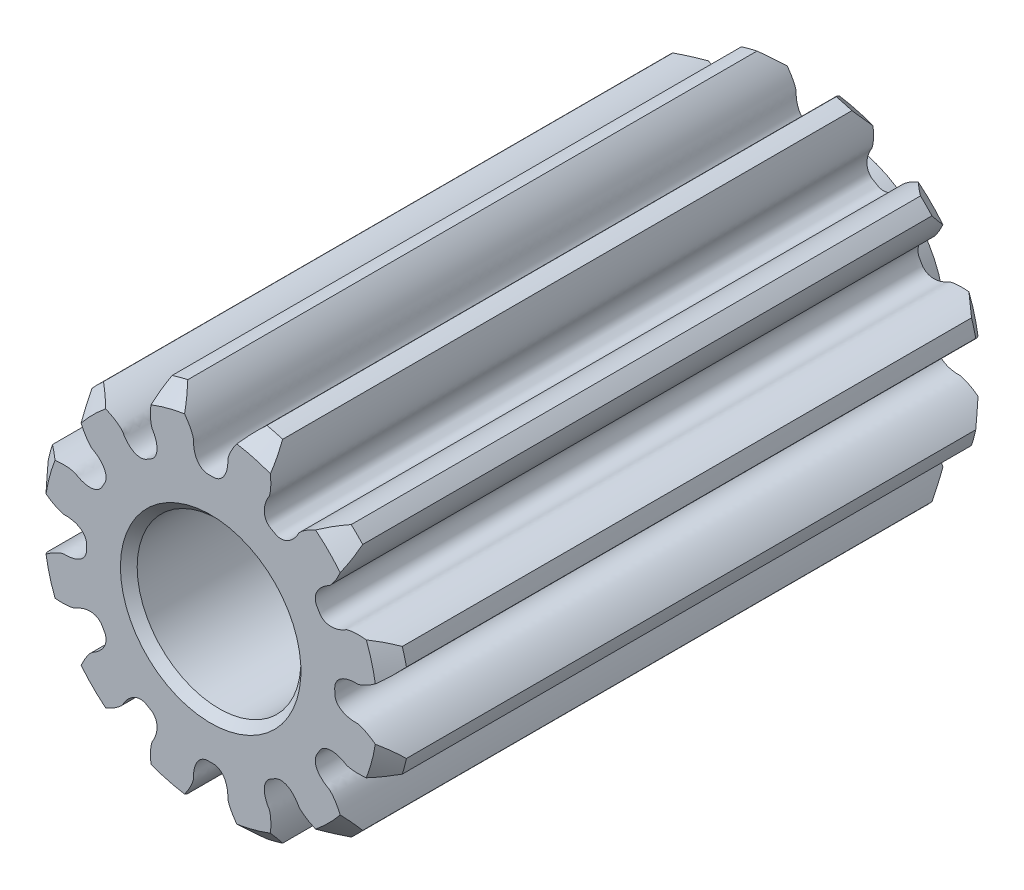
from build123d import *

# Parameters (mm, degrees)
BOSS_EXTRUDE1_DEPTH = 18.25625
SKETCH2_W           = 3.175
SKETCH2_H           = 0.79375
HOLE1_D             = 4.96
CHAMFER1_SIZE       = 0.506249917
CHAMFER2_SIZE       = 0.254


with BuildPart() as part:
    # Sketch1 → Boss-Extrude1 (new body)
    with BuildSketch(Plane(origin=(0, 0, -9.128125), x_dir=(-1, 0, 0), z_dir=(0, 0, -1))):
        with BuildLine():
            ThreePointArc((5.425404811, 1.198705874), (5.366925292, 1.438063298), (5.297891329, 1.674592667))
            add(Edge.make_bspline(
                [(4.099185456, 3.750812144), (4.086881035, 3.688640208), (4.064604326, 3.590945408), (4.02813799, 3.461113263), (3.99626632, 3.362067314), (3.9628593, 3.270211892), (3.928408579, 3.18551446), (3.89340095, 3.107915744), (3.858317055, 3.037330019), (3.823629702, 2.973646168), (3.789804001, 2.916725842), (3.757291548, 2.866411455), (3.726543897, 2.822502764), (3.697965079, 2.784833114), (3.672053296, 2.753036797), (3.641006873, 2.718353198), (3.59159899, 2.664235735), (3.526946165, 2.638473929), (3.483312752, 2.608272859), (3.466630583, 2.596628637), (3.450399741, 2.584768304), (3.434565137, 2.572768612), (3.419140626, 2.560609744), (3.404121993, 2.548296621), (3.389509904, 2.535826904), (3.375303916, 2.523199365), (3.361504116, 2.51041161), (3.348110765, 2.497460614), (3.335124485, 2.484342504), (3.322546306, 2.471052542), (3.310377786, 2.457585059), (3.298621119, 2.443933394), (3.287279279, 2.430089842), (3.276356182, 2.416045606), (3.265856873, 2.401790763), (3.255787748, 2.387314241), (3.246156803, 2.372603823), (3.236973924, 2.357646183), (3.228251208, 2.342426965), (3.220003331, 2.326930917), (3.212247941, 2.311142103), (3.205006094, 2.295044208), (3.198302702, 2.278620954), (3.192166986, 2.261856669), (3.186632917, 2.244737011), (3.181739591, 2.227249898), (3.1775315, 2.20938664), (3.174058639, 2.19114331), (3.171376358, 2.172522315), (3.169544887, 2.153534172), (3.168628422, 2.134199395), (3.168693701, 2.114550391), (3.169807975, 2.094633216), (3.172036424, 2.074508986), (3.175438847, 2.054254629), (3.180066516, 2.033963078), (3.185956648, 2.013741316), (3.193135367, 1.993711363), (3.201589626, 1.973994349), (3.21035214, 1.956736732), (3.228226008, 1.92517919), (3.256197091, 1.879966267), (3.28136709, 1.833136137), (3.299759788, 1.801878143), (3.310324066, 1.785660774), (3.323172372, 1.768480664), (3.33692946, 1.752248735), (3.351496954, 1.737036849), (3.366756118, 1.722883395), (3.382595694, 1.709809632), (3.398909564, 1.697817624), (3.415601207, 1.686894046), (3.432585104, 1.677013012), (3.449787745, 1.668139304), (3.467147694, 1.660231334), (3.484615089, 1.65324376), (3.502150708, 1.64712968), (3.519724787, 1.641842365), (3.537315735, 1.637336553), (3.554908828, 1.633569368), (3.572494983, 1.630500912), (3.590069634, 1.628094593), (3.607631744, 1.626317269), (3.625182952, 1.625139226), (3.642726862, 1.624534073), (3.66026845, 1.624478558), (3.677813586, 1.624952344), (3.695368654, 1.625937778), (3.712940252, 1.627419636), (3.730534962, 1.629384883), (3.748159176, 1.631822445), (3.765818964, 1.63472299), (3.783519987, 1.638078729), (3.801267429, 1.641883235), (3.819065962, 1.646131277), (3.836919719, 1.650818671), (3.854832286, 1.655942154), (3.872806707, 1.661499254), (3.890845471, 1.667488232), (3.908950606, 1.673907813), (3.927123401, 1.680757769), (3.945365544, 1.688036353), (3.963674884, 1.695749677), (3.982061656, 1.703875832), (4.000486931, 1.712500903), (4.048458532, 1.735188012), (4.103095323, 1.778298098), (4.174666362, 1.794027848), (4.220226452, 1.80357304), (4.260718762, 1.810115143), (4.307631045, 1.816030302), (4.361030912, 1.820704202), (4.420860676, 1.823703619), (4.487067974, 1.824537372), (4.559563484, 1.822735576), (4.638234462, 1.817826258), (4.722940736, 1.809344396), (4.813516224, 1.79683088), (4.909768863, 1.779834496), (5.011481006, 1.757913198), (5.14215211, 1.724577899), (5.237896643, 1.695022695), (5.297891329, 1.674592667)],
                knots=[0, 0, 0, 0, 0.042266712, 0.066794083, 0.08991989, 0.111644133, 0.131966811, 0.150887926, 0.168407477, 0.184525464, 0.199241887, 0.212556746, 0.224470042, 0.234981773, 0.24409194, 0.251800543, 0.266086635, 0.292386243, 0.296963202, 0.301485127, 0.305953405, 0.310369519, 0.314735057, 0.319051721, 0.323321334, 0.327545852, 0.331727375, 0.335868154, 0.339970606, 0.344037327, 0.3480711, 0.352074915, 0.356051976, 0.360005716, 0.363939813, 0.367858195, 0.371765054, 0.375664854, 0.37956233, 0.383462485, 0.387370588, 0.391292146, 0.395232877, 0.399198668, 0.403195503, 0.407229386, 0.411306226, 0.415431702, 0.419611098, 0.423849105, 0.428149603, 0.432515421, 0.436948094, 0.441447622, 0.446012269, 0.450638412, 0.455320478, 0.460050978, 0.464820672, 0.469618854, 0.472950852, 0.489007278, 0.505063703, 0.508395701, 0.513193884, 0.517963578, 0.522694077, 0.527376143, 0.532002286, 0.536566933, 0.541066461, 0.545499134, 0.549864952, 0.55416545, 0.558403457, 0.562582853, 0.566708329, 0.570785169, 0.574819052, 0.578815887, 0.582781678, 0.586722409, 0.590643967, 0.59455207, 0.598452225, 0.602349701, 0.606249501, 0.61015636, 0.614074742, 0.618008839, 0.621962579, 0.62593964, 0.629943455, 0.633977228, 0.638043949, 0.642146401, 0.64628718, 0.650468703, 0.654693221, 0.658962834, 0.663279498, 0.667645036, 0.67206115, 0.676529428, 0.681051353, 0.685628312, 0.71192792, 0.726214012, 0.733922615, 0.743032782, 0.753544513, 0.765457809, 0.778772668, 0.793489091, 0.809607078, 0.827126629, 0.846047744, 0.866370423, 0.888094665, 0.911220472, 0.935747843, 0.978014555, 0.978014555, 0.978014555, 0.978014555], degree=3))
            ThreePointArc((4.099185456, 3.750812144), (3.928861994, 3.928861994), (3.750812144, 4.099185455))
            add(Edge.make_bspline(
                [(1.674592667, 5.297891329), (1.695022694, 5.237896643), (1.724577899, 5.14215211), (1.757913198, 5.011481006), (1.779834496, 4.909768863), (1.79683088, 4.813516224), (1.809344396, 4.722940736), (1.817826258, 4.638234462), (1.822735576, 4.559563484), (1.824537372, 4.487067974), (1.823703618, 4.420860676), (1.820704202, 4.361030912), (1.816030301, 4.307631045), (1.810115143, 4.260718762), (1.80357304, 4.220226452), (1.794027848, 4.174666362), (1.778298097, 4.103095323), (1.735188012, 4.048458532), (1.712500903, 4.000486931), (1.703875832, 3.982061656), (1.695749677, 3.963674884), (1.688036353, 3.945365544), (1.680757769, 3.927123401), (1.673907813, 3.908950606), (1.667488232, 3.890845471), (1.661499254, 3.872806707), (1.655942154, 3.854832286), (1.65081867, 3.836919719), (1.646131277, 3.819065962), (1.641883235, 3.801267429), (1.638078729, 3.783519986), (1.63472299, 3.765818964), (1.631822444, 3.748159176), (1.629384882, 3.730534962), (1.627419636, 3.712940252), (1.625937778, 3.695368654), (1.624952344, 3.677813586), (1.624478557, 3.66026845), (1.624534073, 3.642726862), (1.625139226, 3.625182952), (1.626317269, 3.607631744), (1.628094593, 3.590069634), (1.630500911, 3.572494983), (1.633569368, 3.554908828), (1.637336553, 3.537315735), (1.641842365, 3.519724787), (1.64712968, 3.502150707), (1.653243759, 3.484615089), (1.660231334, 3.467147694), (1.668139304, 3.449787745), (1.677013011, 3.432585104), (1.686894046, 3.415601207), (1.697817624, 3.398909564), (1.709809632, 3.382595694), (1.722883395, 3.366756118), (1.737036849, 3.351496954), (1.752248734, 3.33692946), (1.768480664, 3.323172372), (1.785660774, 3.310324066), (1.801878142, 3.299759788), (1.833136137, 3.28136709), (1.879966267, 3.256197091), (1.92517919, 3.228226008), (1.956736732, 3.21035214), (1.973994349, 3.201589626), (1.993711363, 3.193135367), (2.013741315, 3.185956648), (2.033963078, 3.180066516), (2.054254629, 3.175438846), (2.074508986, 3.172036424), (2.094633216, 3.169807975), (2.114550391, 3.168693701), (2.134199395, 3.168628422), (2.153534172, 3.169544887), (2.172522315, 3.171376358), (2.19114331, 3.174058639), (2.20938664, 3.1775315), (2.227249897, 3.181739591), (2.244737011, 3.186632917), (2.261856669, 3.192166986), (2.278620954, 3.198302702), (2.295044207, 3.205006094), (2.311142103, 3.212247941), (2.326930917, 3.220003331), (2.342426965, 3.228251208), (2.357646183, 3.236973924), (2.372603823, 3.246156803), (2.387314241, 3.255787748), (2.401790763, 3.265856873), (2.416045606, 3.276356182), (2.430089841, 3.287279279), (2.443933394, 3.298621119), (2.457585059, 3.310377786), (2.471052542, 3.322546306), (2.484342503, 3.335124485), (2.497460614, 3.348110765), (2.51041161, 3.361504116), (2.523199365, 3.375303916), (2.535826904, 3.389509904), (2.548296621, 3.404121993), (2.560609744, 3.419140626), (2.572768612, 3.434565137), (2.584768304, 3.450399741), (2.596628637, 3.466630583), (2.608272859, 3.483312751), (2.638473929, 3.526946165), (2.664235735, 3.59159899), (2.718353198, 3.641006873), (2.753036797, 3.672053296), (2.784833114, 3.697965079), (2.822502764, 3.726543897), (2.866411455, 3.757291548), (2.916725842, 3.789804), (2.973646168, 3.823629701), (3.037330019, 3.858317055), (3.107915743, 3.89340095), (3.18551446, 3.928408579), (3.270211892, 3.9628593), (3.362067314, 3.99626632), (3.461113263, 4.02813799), (3.590945408, 4.064604326), (3.688640208, 4.086881035), (3.750812144, 4.099185455)],
                knots=[0, 0, 0, 0, 0.042266712, 0.066794083, 0.08991989, 0.111644133, 0.131966811, 0.150887926, 0.168407477, 0.184525464, 0.199241887, 0.212556747, 0.224470042, 0.234981773, 0.24409194, 0.251800544, 0.266086635, 0.292386243, 0.296963202, 0.301485127, 0.305953405, 0.310369519, 0.314735057, 0.319051721, 0.323321334, 0.327545852, 0.331727375, 0.335868154, 0.339970606, 0.344037327, 0.3480711, 0.352074915, 0.356051976, 0.360005716, 0.363939813, 0.367858195, 0.371765054, 0.375664854, 0.37956233, 0.383462485, 0.387370588, 0.391292146, 0.395232877, 0.399198668, 0.403195503, 0.407229386, 0.411306226, 0.415431702, 0.419611098, 0.423849105, 0.428149603, 0.432515421, 0.436948094, 0.441447622, 0.446012269, 0.450638412, 0.455320478, 0.460050978, 0.464820672, 0.469618854, 0.472950852, 0.489007278, 0.505063703, 0.508395701, 0.513193884, 0.517963578, 0.522694077, 0.527376143, 0.532002286, 0.536566933, 0.541066461, 0.545499134, 0.549864952, 0.55416545, 0.558403457, 0.562582853, 0.566708329, 0.570785169, 0.574819052, 0.578815887, 0.582781678, 0.586722409, 0.590643967, 0.59455207, 0.598452225, 0.602349701, 0.606249501, 0.61015636, 0.614074742, 0.618008839, 0.621962579, 0.62593964, 0.629943455, 0.633977228, 0.638043949, 0.642146401, 0.64628718, 0.650468703, 0.654693221, 0.658962834, 0.663279498, 0.667645036, 0.67206115, 0.676529428, 0.681051353, 0.685628312, 0.71192792, 0.726214012, 0.733922615, 0.743032782, 0.753544513, 0.765457809, 0.778772668, 0.793489091, 0.809607078, 0.827126629, 0.846047744, 0.866370423, 0.888094665, 0.911220472, 0.935747843, 0.978014555, 0.978014555, 0.978014555, 0.978014555], degree=3))
            ThreePointArc((1.674592667, 5.297891329), (1.438063298, 5.366925292), (1.198705874, 5.425404811))
            add(Edge.make_bspline(
                [(-1.198705874, 5.425404811), (-1.151015608, 5.383662902), (-1.077547784, 5.315523307), (-0.983343016, 5.21902646), (-0.913502543, 5.14190181), (-0.850656924, 5.067042771), (-0.794532157, 4.994858856), (-0.744833512, 4.925742002), (-0.701246428, 4.860065595), (-0.663438273, 4.79818354), (-0.631056675, 4.740429461), (-0.603739364, 4.687115658), (-0.581087147, 4.638533065), (-0.562753683, 4.594948258), (-0.548173156, 4.556609837), (-0.533659489, 4.512381046), (-0.511496334, 4.442533833), (-0.521512367, 4.373661941), (-0.51717418, 4.320773761), (-0.515431073, 4.300504469), (-0.513275143, 4.280517981), (-0.510800408, 4.260804965), (-0.507982775, 4.241367513), (-0.504828613, 4.222204434), (-0.501335566, 4.203315136), (-0.497502791, 4.184698619), (-0.493328171, 4.166353764), (-0.488808954, 4.148279284), (-0.483941477, 4.13047378), (-0.478721123, 4.112935778), (-0.4731422, 4.095663789), (-0.467197845, 4.078656384), (-0.460879897, 4.061912286), (-0.45417878, 4.045430488), (-0.447083379, 4.029210399), (-0.439580906, 4.01325202), (-0.431656783, 3.997556168), (-0.423294526, 3.982124741), (-0.414475654, 3.966961038), (-0.405179621, 3.952070143), (-0.395383802, 3.937459372), (-0.385063539, 3.923138801), (-0.374192281, 3.909121865), (-0.362741842, 3.895426037), (-0.350682818, 3.882073564), (-0.337985196, 3.869092263), (-0.324619207, 3.856516321), (-0.31055645, 3.844387069), (-0.295771336, 3.832753648), (-0.280242858, 3.821673477), (-0.263956681, 3.811212406), (-0.246907506, 3.801444437), (-0.229101589, 3.79245084), (-0.21055927, 3.784318618), (-0.191317271, 3.777138024), (-0.171430438, 3.770999927), (-0.150972812, 3.76599005), (-0.130037005, 3.762192027), (-0.10873444, 3.759655123), (-0.089407648, 3.758614874), (-0.053141081, 3.758315327), (0, 3.759932534), (0.053141081, 3.758315327), (0.089407648, 3.758614874), (0.10873444, 3.759655123), (0.130037005, 3.762192027), (0.150972812, 3.76599005), (0.171430438, 3.770999927), (0.191317271, 3.777138024), (0.21055927, 3.784318618), (0.229101589, 3.79245084), (0.246907506, 3.801444437), (0.263956681, 3.811212406), (0.280242858, 3.821673477), (0.295771336, 3.832753648), (0.31055645, 3.844387069), (0.324619207, 3.856516321), (0.337985197, 3.869092263), (0.350682818, 3.882073564), (0.362741842, 3.895426037), (0.374192281, 3.909121866), (0.385063539, 3.923138801), (0.395383802, 3.937459372), (0.405179621, 3.952070143), (0.414475654, 3.966961038), (0.423294526, 3.982124741), (0.431656783, 3.997556168), (0.439580906, 4.01325202), (0.447083379, 4.029210399), (0.45417878, 4.045430488), (0.460879897, 4.061912286), (0.467197845, 4.078656384), (0.4731422, 4.095663789), (0.478721123, 4.112935778), (0.483941478, 4.13047378), (0.488808954, 4.148279285), (0.493328171, 4.166353764), (0.497502791, 4.184698619), (0.501335566, 4.203315136), (0.504828613, 4.222204434), (0.507982775, 4.241367513), (0.510800408, 4.260804965), (0.513275143, 4.280517981), (0.515431073, 4.300504469), (0.51717418, 4.320773761), (0.521512367, 4.373661941), (0.511496334, 4.442533833), (0.533659489, 4.512381046), (0.548173156, 4.556609837), (0.562753683, 4.594948258), (0.581087147, 4.638533066), (0.603739364, 4.687115658), (0.631056675, 4.740429461), (0.663438273, 4.79818354), (0.701246428, 4.860065595), (0.744833512, 4.925742002), (0.794532157, 4.994858856), (0.850656924, 5.067042771), (0.913502543, 5.14190181), (0.983343016, 5.219026461), (1.077547784, 5.315523307), (1.151015608, 5.383662902), (1.198705874, 5.425404811)],
                knots=[0, 0, 0, 0, 0.042266712, 0.066794083, 0.08991989, 0.111644133, 0.131966811, 0.150887926, 0.168407477, 0.184525464, 0.199241887, 0.212556747, 0.224470042, 0.234981773, 0.24409194, 0.251800544, 0.266086635, 0.292386243, 0.296963202, 0.301485127, 0.305953405, 0.310369519, 0.314735057, 0.319051721, 0.323321334, 0.327545852, 0.331727375, 0.335868154, 0.339970606, 0.344037327, 0.3480711, 0.352074915, 0.356051976, 0.360005716, 0.363939813, 0.367858195, 0.371765054, 0.375664854, 0.37956233, 0.383462485, 0.387370588, 0.391292146, 0.395232877, 0.399198668, 0.403195503, 0.407229386, 0.411306226, 0.415431702, 0.419611098, 0.423849105, 0.428149603, 0.432515421, 0.436948094, 0.441447622, 0.446012269, 0.450638412, 0.455320478, 0.460050978, 0.464820672, 0.469618854, 0.472950852, 0.489007278, 0.505063703, 0.508395701, 0.513193884, 0.517963578, 0.522694077, 0.527376143, 0.532002286, 0.536566933, 0.541066461, 0.545499134, 0.549864952, 0.55416545, 0.558403457, 0.562582853, 0.566708329, 0.570785169, 0.574819052, 0.578815887, 0.582781678, 0.586722409, 0.590643967, 0.59455207, 0.598452225, 0.602349701, 0.606249501, 0.61015636, 0.614074742, 0.618008839, 0.621962579, 0.62593964, 0.629943455, 0.633977228, 0.638043949, 0.642146401, 0.64628718, 0.650468703, 0.654693221, 0.658962834, 0.663279498, 0.667645036, 0.67206115, 0.676529428, 0.681051353, 0.685628312, 0.71192792, 0.726214012, 0.733922615, 0.743032782, 0.753544513, 0.765457809, 0.778772668, 0.793489091, 0.809607078, 0.827126629, 0.846047744, 0.866370423, 0.888094665, 0.911220472, 0.935747843, 0.978014555, 0.978014555, 0.978014555, 0.978014555], degree=3))
            ThreePointArc((-1.198705874, 5.425404811), (-1.438063298, 5.366925292), (-1.674592667, 5.297891329))
            add(Edge.make_bspline(
                [(-3.750812144, 4.099185456), (-3.688640208, 4.086881035), (-3.590945408, 4.064604326), (-3.461113263, 4.02813799), (-3.362067314, 3.99626632), (-3.270211892, 3.9628593), (-3.18551446, 3.928408579), (-3.107915744, 3.89340095), (-3.037330019, 3.858317055), (-2.973646168, 3.823629702), (-2.916725842, 3.789804001), (-2.866411455, 3.757291548), (-2.822502764, 3.726543897), (-2.784833114, 3.697965079), (-2.753036797, 3.672053296), (-2.718353198, 3.641006873), (-2.664235735, 3.59159899), (-2.638473929, 3.526946165), (-2.608272859, 3.483312752), (-2.596628637, 3.466630583), (-2.584768304, 3.450399741), (-2.572768612, 3.434565137), (-2.560609744, 3.419140626), (-2.548296621, 3.404121993), (-2.535826904, 3.389509904), (-2.523199365, 3.375303916), (-2.51041161, 3.361504116), (-2.497460614, 3.348110765), (-2.484342504, 3.335124485), (-2.471052542, 3.322546306), (-2.457585059, 3.310377786), (-2.443933394, 3.298621119), (-2.430089842, 3.287279279), (-2.416045606, 3.276356182), (-2.401790763, 3.265856873), (-2.387314241, 3.255787748), (-2.372603823, 3.246156803), (-2.357646183, 3.236973924), (-2.342426965, 3.228251208), (-2.326930917, 3.220003331), (-2.311142103, 3.212247941), (-2.295044208, 3.205006094), (-2.278620954, 3.198302702), (-2.261856669, 3.192166986), (-2.244737011, 3.186632917), (-2.227249898, 3.181739591), (-2.20938664, 3.1775315), (-2.19114331, 3.174058639), (-2.172522315, 3.171376358), (-2.153534172, 3.169544887), (-2.134199395, 3.168628422), (-2.114550391, 3.168693701), (-2.094633216, 3.169807975), (-2.074508986, 3.172036424), (-2.054254629, 3.175438847), (-2.033963078, 3.180066516), (-2.013741316, 3.185956648), (-1.993711363, 3.193135367), (-1.973994349, 3.201589626), (-1.956736732, 3.21035214), (-1.92517919, 3.228226008), (-1.879966267, 3.256197091), (-1.833136137, 3.28136709), (-1.801878143, 3.299759788), (-1.785660774, 3.310324066), (-1.768480664, 3.323172372), (-1.752248735, 3.33692946), (-1.737036849, 3.351496954), (-1.722883395, 3.366756118), (-1.709809632, 3.382595694), (-1.697817624, 3.398909564), (-1.686894046, 3.415601207), (-1.677013012, 3.432585104), (-1.668139304, 3.449787745), (-1.660231334, 3.467147694), (-1.65324376, 3.484615089), (-1.64712968, 3.502150707), (-1.641842365, 3.519724787), (-1.637336553, 3.537315735), (-1.633569368, 3.554908828), (-1.630500912, 3.572494983), (-1.628094593, 3.590069634), (-1.626317269, 3.607631744), (-1.625139226, 3.625182952), (-1.624534073, 3.642726862), (-1.624478558, 3.66026845), (-1.624952344, 3.677813586), (-1.625937778, 3.695368654), (-1.627419636, 3.712940252), (-1.629384882, 3.730534962), (-1.631822445, 3.748159176), (-1.63472299, 3.765818964), (-1.638078729, 3.783519986), (-1.641883235, 3.801267429), (-1.646131277, 3.819065962), (-1.650818671, 3.836919719), (-1.655942154, 3.854832286), (-1.661499254, 3.872806707), (-1.667488232, 3.890845471), (-1.673907813, 3.908950606), (-1.680757769, 3.927123401), (-1.688036353, 3.945365544), (-1.695749677, 3.963674884), (-1.703875832, 3.982061656), (-1.712500903, 4.000486931), (-1.735188012, 4.048458532), (-1.778298098, 4.103095323), (-1.794027848, 4.174666362), (-1.80357304, 4.220226452), (-1.810115143, 4.260718762), (-1.816030302, 4.307631045), (-1.820704202, 4.361030912), (-1.823703619, 4.420860676), (-1.824537372, 4.487067974), (-1.822735576, 4.559563484), (-1.817826258, 4.638234462), (-1.809344396, 4.722940736), (-1.79683088, 4.813516224), (-1.779834496, 4.909768863), (-1.757913198, 5.011481006), (-1.724577899, 5.14215211), (-1.695022695, 5.237896643), (-1.674592667, 5.297891329)],
                knots=[0, 0, 0, 0, 0.042266712, 0.066794083, 0.08991989, 0.111644133, 0.131966811, 0.150887926, 0.168407477, 0.184525464, 0.199241887, 0.212556746, 0.224470042, 0.234981773, 0.24409194, 0.251800543, 0.266086635, 0.292386243, 0.296963202, 0.301485127, 0.305953405, 0.310369519, 0.314735057, 0.319051721, 0.323321334, 0.327545852, 0.331727375, 0.335868154, 0.339970606, 0.344037327, 0.3480711, 0.352074915, 0.356051976, 0.360005716, 0.363939813, 0.367858195, 0.371765054, 0.375664854, 0.37956233, 0.383462485, 0.387370588, 0.391292146, 0.395232877, 0.399198668, 0.403195503, 0.407229386, 0.411306226, 0.415431702, 0.419611098, 0.423849105, 0.428149603, 0.432515421, 0.436948094, 0.441447622, 0.446012269, 0.450638412, 0.455320478, 0.460050978, 0.464820672, 0.469618854, 0.472950852, 0.489007278, 0.505063703, 0.508395701, 0.513193884, 0.517963578, 0.522694077, 0.527376143, 0.532002286, 0.536566933, 0.541066461, 0.545499134, 0.549864952, 0.55416545, 0.558403457, 0.562582853, 0.566708329, 0.570785169, 0.574819052, 0.578815887, 0.582781678, 0.586722409, 0.590643967, 0.59455207, 0.598452225, 0.602349701, 0.606249501, 0.61015636, 0.614074742, 0.618008839, 0.621962579, 0.62593964, 0.629943455, 0.633977228, 0.638043949, 0.642146401, 0.64628718, 0.650468703, 0.654693221, 0.658962834, 0.663279498, 0.667645036, 0.67206115, 0.676529428, 0.681051353, 0.685628312, 0.71192792, 0.726214012, 0.733922615, 0.743032782, 0.753544513, 0.765457809, 0.778772668, 0.793489091, 0.809607078, 0.827126629, 0.846047744, 0.866370423, 0.888094665, 0.911220472, 0.935747843, 0.978014555, 0.978014555, 0.978014555, 0.978014555], degree=3))
            ThreePointArc((-3.750812144, 4.099185456), (-3.928861994, 3.928861994), (-4.099185455, 3.750812144))
            add(Edge.make_bspline(
                [(-5.297891329, 1.674592667), (-5.237896643, 1.695022695), (-5.14215211, 1.724577899), (-5.011481006, 1.757913198), (-4.909768863, 1.779834496), (-4.813516224, 1.79683088), (-4.722940736, 1.809344396), (-4.638234462, 1.817826258), (-4.559563484, 1.822735576), (-4.487067974, 1.824537372), (-4.420860676, 1.823703619), (-4.361030912, 1.820704202), (-4.307631045, 1.816030301), (-4.260718762, 1.810115143), (-4.220226452, 1.80357304), (-4.174666362, 1.794027848), (-4.103095323, 1.778298098), (-4.048458532, 1.735188012), (-4.000486931, 1.712500903), (-3.982061656, 1.703875832), (-3.963674884, 1.695749677), (-3.945365544, 1.688036353), (-3.927123401, 1.680757769), (-3.908950606, 1.673907813), (-3.890845471, 1.667488232), (-3.872806707, 1.661499254), (-3.854832286, 1.655942154), (-3.836919719, 1.650818671), (-3.819065962, 1.646131277), (-3.801267429, 1.641883235), (-3.783519986, 1.638078729), (-3.765818964, 1.63472299), (-3.748159176, 1.631822444), (-3.730534962, 1.629384882), (-3.712940252, 1.627419636), (-3.695368654, 1.625937778), (-3.677813586, 1.624952344), (-3.66026845, 1.624478557), (-3.642726862, 1.624534073), (-3.625182952, 1.625139226), (-3.607631744, 1.626317269), (-3.590069634, 1.628094593), (-3.572494982, 1.630500911), (-3.554908828, 1.633569368), (-3.537315735, 1.637336553), (-3.519724787, 1.641842365), (-3.502150707, 1.64712968), (-3.484615089, 1.653243759), (-3.467147694, 1.660231334), (-3.449787745, 1.668139304), (-3.432585104, 1.677013012), (-3.415601207, 1.686894046), (-3.398909564, 1.697817624), (-3.382595694, 1.709809632), (-3.366756118, 1.722883395), (-3.351496954, 1.737036849), (-3.33692946, 1.752248734), (-3.323172372, 1.768480664), (-3.310324066, 1.785660774), (-3.299759788, 1.801878142), (-3.28136709, 1.833136137), (-3.256197091, 1.879966267), (-3.228226008, 1.92517919), (-3.21035214, 1.956736732), (-3.201589626, 1.973994349), (-3.193135367, 1.993711363), (-3.185956648, 2.013741315), (-3.180066516, 2.033963078), (-3.175438846, 2.054254629), (-3.172036424, 2.074508986), (-3.169807975, 2.094633216), (-3.168693701, 2.114550391), (-3.168628422, 2.134199395), (-3.169544887, 2.153534172), (-3.171376358, 2.172522315), (-3.174058639, 2.19114331), (-3.1775315, 2.20938664), (-3.181739591, 2.227249898), (-3.186632917, 2.244737011), (-3.192166986, 2.261856669), (-3.198302701, 2.278620954), (-3.205006094, 2.295044207), (-3.212247941, 2.311142103), (-3.220003331, 2.326930917), (-3.228251208, 2.342426965), (-3.236973924, 2.357646183), (-3.246156803, 2.372603823), (-3.255787748, 2.387314241), (-3.265856873, 2.401790763), (-3.276356182, 2.416045606), (-3.287279279, 2.430089841), (-3.298621119, 2.443933394), (-3.310377786, 2.457585059), (-3.322546306, 2.471052542), (-3.335124485, 2.484342504), (-3.348110765, 2.497460614), (-3.361504116, 2.51041161), (-3.375303916, 2.523199365), (-3.389509904, 2.535826904), (-3.404121993, 2.548296621), (-3.419140626, 2.560609744), (-3.434565137, 2.572768612), (-3.450399741, 2.584768304), (-3.466630583, 2.596628637), (-3.483312751, 2.608272859), (-3.526946165, 2.638473929), (-3.59159899, 2.664235735), (-3.641006873, 2.718353198), (-3.672053296, 2.753036797), (-3.697965079, 2.784833114), (-3.726543897, 2.822502764), (-3.757291548, 2.866411455), (-3.789804, 2.916725842), (-3.823629701, 2.973646168), (-3.858317055, 3.037330019), (-3.89340095, 3.107915743), (-3.928408579, 3.18551446), (-3.9628593, 3.270211892), (-3.99626632, 3.362067314), (-4.02813799, 3.461113263), (-4.064604326, 3.590945408), (-4.086881035, 3.688640208), (-4.099185455, 3.750812144)],
                knots=[0, 0, 0, 0, 0.042266712, 0.066794083, 0.08991989, 0.111644133, 0.131966811, 0.150887926, 0.168407477, 0.184525464, 0.199241887, 0.212556747, 0.224470042, 0.234981773, 0.24409194, 0.251800544, 0.266086635, 0.292386243, 0.296963202, 0.301485127, 0.305953405, 0.310369519, 0.314735057, 0.319051721, 0.323321334, 0.327545852, 0.331727375, 0.335868154, 0.339970606, 0.344037327, 0.3480711, 0.352074915, 0.356051976, 0.360005716, 0.363939813, 0.367858195, 0.371765054, 0.375664854, 0.37956233, 0.383462485, 0.387370588, 0.391292146, 0.395232877, 0.399198668, 0.403195503, 0.407229386, 0.411306226, 0.415431702, 0.419611098, 0.423849105, 0.428149603, 0.432515421, 0.436948094, 0.441447622, 0.446012269, 0.450638412, 0.455320478, 0.460050978, 0.464820672, 0.469618854, 0.472950852, 0.489007278, 0.505063703, 0.508395701, 0.513193884, 0.517963578, 0.522694077, 0.527376143, 0.532002286, 0.536566933, 0.541066461, 0.545499134, 0.549864952, 0.55416545, 0.558403457, 0.562582853, 0.566708329, 0.570785169, 0.574819052, 0.578815887, 0.582781678, 0.586722409, 0.590643967, 0.59455207, 0.598452225, 0.602349701, 0.606249501, 0.61015636, 0.614074742, 0.618008839, 0.621962579, 0.62593964, 0.629943455, 0.633977228, 0.638043949, 0.642146401, 0.64628718, 0.650468703, 0.654693221, 0.658962834, 0.663279498, 0.667645036, 0.67206115, 0.676529428, 0.681051353, 0.685628312, 0.71192792, 0.726214012, 0.733922615, 0.743032782, 0.753544513, 0.765457809, 0.778772668, 0.793489091, 0.809607078, 0.827126629, 0.846047744, 0.866370423, 0.888094665, 0.911220472, 0.935747843, 0.978014555, 0.978014555, 0.978014555, 0.978014555], degree=3))
            ThreePointArc((-5.297891329, 1.674592667), (-5.366925292, 1.438063298), (-5.425404811, 1.198705873))
            add(Edge.make_bspline(
                [(-5.425404811, -1.198705873), (-5.383662902, -1.151015608), (-5.315523307, -1.077547784), (-5.219026461, -0.983343016), (-5.14190181, -0.913502543), (-5.067042771, -0.850656924), (-4.994858856, -0.794532157), (-4.925742002, -0.744833512), (-4.860065595, -0.701246428), (-4.79818354, -0.663438273), (-4.740429461, -0.631056675), (-4.687115658, -0.603739364), (-4.638533066, -0.581087147), (-4.594948258, -0.562753683), (-4.556609837, -0.548173156), (-4.512381046, -0.533659489), (-4.442533833, -0.511496334), (-4.373661941, -0.521512367), (-4.320773762, -0.51717418), (-4.300504469, -0.515431073), (-4.280517981, -0.513275143), (-4.260804965, -0.510800408), (-4.241367513, -0.507982775), (-4.222204434, -0.504828613), (-4.203315136, -0.501335566), (-4.184698619, -0.497502791), (-4.166353764, -0.493328171), (-4.148279285, -0.488808954), (-4.13047378, -0.483941478), (-4.112935778, -0.478721123), (-4.095663789, -0.4731422), (-4.078656384, -0.467197845), (-4.061912286, -0.460879897), (-4.045430488, -0.45417878), (-4.029210399, -0.447083379), (-4.01325202, -0.439580906), (-3.997556168, -0.431656783), (-3.982124741, -0.423294526), (-3.966961038, -0.414475654), (-3.952070143, -0.405179621), (-3.937459372, -0.395383802), (-3.923138801, -0.385063539), (-3.909121866, -0.374192281), (-3.895426037, -0.362741842), (-3.882073564, -0.350682818), (-3.869092263, -0.337985196), (-3.856516321, -0.324619207), (-3.844387069, -0.31055645), (-3.832753649, -0.295771336), (-3.821673477, -0.280242858), (-3.811212406, -0.263956681), (-3.801444437, -0.246907506), (-3.79245084, -0.229101589), (-3.784318618, -0.21055927), (-3.777138024, -0.191317271), (-3.770999927, -0.171430438), (-3.76599005, -0.150972812), (-3.762192027, -0.130037005), (-3.759655123, -0.10873444), (-3.758614874, -0.089407648), (-3.758315327, -0.053141081), (-3.759932534, 0), (-3.758315327, 0.053141081), (-3.758614874, 0.089407648), (-3.759655123, 0.10873444), (-3.762192027, 0.130037005), (-3.76599005, 0.150972812), (-3.770999927, 0.171430438), (-3.777138024, 0.191317271), (-3.784318618, 0.21055927), (-3.79245084, 0.229101589), (-3.801444437, 0.246907506), (-3.811212406, 0.263956681), (-3.821673477, 0.280242858), (-3.832753649, 0.295771336), (-3.844387069, 0.31055645), (-3.856516321, 0.324619207), (-3.869092263, 0.337985196), (-3.882073564, 0.350682818), (-3.895426037, 0.362741842), (-3.909121866, 0.374192281), (-3.923138801, 0.385063539), (-3.937459372, 0.395383802), (-3.952070143, 0.405179621), (-3.966961038, 0.414475654), (-3.982124741, 0.423294526), (-3.997556168, 0.431656783), (-4.01325202, 0.439580906), (-4.029210399, 0.447083379), (-4.045430488, 0.45417878), (-4.061912286, 0.460879897), (-4.078656384, 0.467197845), (-4.095663789, 0.4731422), (-4.112935778, 0.478721123), (-4.13047378, 0.483941478), (-4.148279285, 0.488808954), (-4.166353764, 0.493328171), (-4.184698619, 0.497502791), (-4.203315136, 0.501335566), (-4.222204434, 0.504828613), (-4.241367513, 0.507982775), (-4.260804965, 0.510800408), (-4.280517981, 0.513275143), (-4.300504469, 0.515431073), (-4.320773762, 0.51717418), (-4.373661941, 0.521512367), (-4.442533833, 0.511496334), (-4.512381046, 0.533659489), (-4.556609837, 0.548173156), (-4.594948258, 0.562753683), (-4.638533066, 0.581087147), (-4.687115658, 0.603739364), (-4.740429461, 0.631056675), (-4.79818354, 0.663438273), (-4.860065595, 0.701246428), (-4.925742002, 0.744833512), (-4.994858856, 0.794532157), (-5.067042771, 0.850656924), (-5.14190181, 0.913502543), (-5.219026461, 0.983343016), (-5.315523307, 1.077547784), (-5.383662902, 1.151015608), (-5.425404811, 1.198705873)],
                knots=[0, 0, 0, 0, 0.042266712, 0.066794083, 0.08991989, 0.111644133, 0.131966811, 0.150887926, 0.168407477, 0.184525464, 0.199241887, 0.212556746, 0.224470042, 0.234981773, 0.24409194, 0.251800543, 0.266086635, 0.292386243, 0.296963202, 0.301485127, 0.305953405, 0.310369519, 0.314735057, 0.319051721, 0.323321334, 0.327545852, 0.331727375, 0.335868154, 0.339970606, 0.344037327, 0.3480711, 0.352074915, 0.356051976, 0.360005716, 0.363939813, 0.367858195, 0.371765054, 0.375664854, 0.37956233, 0.383462485, 0.387370588, 0.391292146, 0.395232877, 0.399198668, 0.403195503, 0.407229386, 0.411306226, 0.415431702, 0.419611098, 0.423849105, 0.428149603, 0.432515421, 0.436948094, 0.441447622, 0.446012269, 0.450638412, 0.455320478, 0.460050978, 0.464820672, 0.469618854, 0.472950852, 0.489007278, 0.505063703, 0.508395701, 0.513193884, 0.517963578, 0.522694077, 0.527376143, 0.532002286, 0.536566933, 0.541066461, 0.545499134, 0.549864952, 0.55416545, 0.558403457, 0.562582853, 0.566708329, 0.570785169, 0.574819052, 0.578815887, 0.582781678, 0.586722409, 0.590643967, 0.59455207, 0.598452225, 0.602349701, 0.606249501, 0.61015636, 0.614074742, 0.618008839, 0.621962579, 0.62593964, 0.629943455, 0.633977228, 0.638043949, 0.642146401, 0.64628718, 0.650468703, 0.654693221, 0.658962834, 0.663279498, 0.667645036, 0.67206115, 0.676529428, 0.681051353, 0.685628312, 0.71192792, 0.726214012, 0.733922615, 0.743032782, 0.753544513, 0.765457809, 0.778772668, 0.793489091, 0.809607078, 0.827126629, 0.846047744, 0.866370423, 0.888094665, 0.911220472, 0.935747843, 0.978014555, 0.978014555, 0.978014555, 0.978014555], degree=3))
            ThreePointArc((-5.425404811, -1.198705873), (-5.366925292, -1.438063298), (-5.297891329, -1.674592667))
            add(Edge.make_bspline(
                [(-4.099185455, -3.750812144), (-4.086881035, -3.688640208), (-4.064604326, -3.590945408), (-4.02813799, -3.461113263), (-3.99626632, -3.362067314), (-3.9628593, -3.270211892), (-3.928408579, -3.18551446), (-3.89340095, -3.107915744), (-3.858317055, -3.037330019), (-3.823629701, -2.973646168), (-3.789804, -2.916725843), (-3.757291548, -2.866411455), (-3.726543897, -2.822502764), (-3.697965079, -2.784833115), (-3.672053296, -2.753036797), (-3.641006873, -2.718353198), (-3.59159899, -2.664235735), (-3.526946165, -2.638473929), (-3.483312751, -2.608272859), (-3.466630583, -2.596628637), (-3.450399741, -2.584768304), (-3.434565137, -2.572768612), (-3.419140626, -2.560609744), (-3.404121993, -2.548296621), (-3.389509904, -2.535826904), (-3.375303916, -2.523199365), (-3.361504116, -2.51041161), (-3.348110765, -2.497460614), (-3.335124485, -2.484342504), (-3.322546306, -2.471052543), (-3.310377786, -2.457585059), (-3.298621119, -2.443933394), (-3.287279279, -2.430089842), (-3.276356182, -2.416045606), (-3.265856873, -2.401790763), (-3.255787748, -2.387314241), (-3.246156803, -2.372603823), (-3.236973924, -2.357646184), (-3.228251208, -2.342426965), (-3.220003331, -2.326930917), (-3.212247941, -2.311142103), (-3.205006094, -2.295044208), (-3.198302701, -2.278620954), (-3.192166986, -2.261856669), (-3.186632917, -2.244737011), (-3.181739591, -2.227249898), (-3.1775315, -2.209386641), (-3.174058639, -2.19114331), (-3.171376358, -2.172522315), (-3.169544887, -2.153534172), (-3.168628422, -2.134199395), (-3.168693701, -2.114550391), (-3.169807975, -2.094633216), (-3.172036424, -2.074508986), (-3.175438846, -2.054254629), (-3.180066516, -2.033963078), (-3.185956648, -2.013741316), (-3.193135367, -1.993711363), (-3.201589626, -1.973994349), (-3.21035214, -1.956736732), (-3.228226008, -1.92517919), (-3.256197091, -1.879966267), (-3.281367089, -1.833136137), (-3.299759788, -1.801878143), (-3.310324066, -1.785660774), (-3.323172372, -1.768480664), (-3.33692946, -1.752248735), (-3.351496954, -1.737036849), (-3.366756117, -1.722883395), (-3.382595694, -1.709809632), (-3.398909564, -1.697817624), (-3.415601207, -1.686894046), (-3.432585104, -1.677013012), (-3.449787745, -1.668139305), (-3.467147694, -1.660231334), (-3.484615089, -1.65324376), (-3.502150707, -1.64712968), (-3.519724787, -1.641842365), (-3.537315735, -1.637336553), (-3.554908828, -1.633569368), (-3.572494982, -1.630500912), (-3.590069634, -1.628094593), (-3.607631743, -1.626317269), (-3.625182952, -1.625139226), (-3.642726862, -1.624534074), (-3.66026845, -1.624478558), (-3.677813586, -1.624952345), (-3.695368653, -1.625937778), (-3.712940252, -1.627419636), (-3.730534962, -1.629384883), (-3.748159176, -1.631822445), (-3.765818964, -1.63472299), (-3.783519986, -1.638078729), (-3.801267429, -1.641883235), (-3.819065962, -1.646131277), (-3.836919719, -1.650818671), (-3.854832286, -1.655942154), (-3.872806707, -1.661499254), (-3.890845471, -1.667488232), (-3.908950606, -1.673907813), (-3.927123401, -1.680757769), (-3.945365544, -1.688036353), (-3.963674884, -1.695749677), (-3.982061656, -1.703875832), (-4.000486931, -1.712500903), (-4.048458532, -1.735188012), (-4.103095323, -1.778298098), (-4.174666362, -1.794027848), (-4.220226452, -1.80357304), (-4.260718762, -1.810115143), (-4.307631044, -1.816030302), (-4.361030912, -1.820704202), (-4.420860676, -1.823703619), (-4.487067974, -1.824537372), (-4.559563483, -1.822735576), (-4.638234462, -1.817826258), (-4.722940736, -1.809344396), (-4.813516224, -1.79683088), (-4.909768863, -1.779834496), (-5.011481006, -1.757913198), (-5.14215211, -1.724577899), (-5.237896643, -1.695022695), (-5.297891329, -1.674592667)],
                knots=[0, 0, 0, 0, 0.042266712, 0.066794083, 0.08991989, 0.111644133, 0.131966811, 0.150887926, 0.168407477, 0.184525464, 0.199241887, 0.212556746, 0.224470042, 0.234981773, 0.24409194, 0.251800543, 0.266086635, 0.292386243, 0.296963202, 0.301485127, 0.305953405, 0.310369519, 0.314735057, 0.319051721, 0.323321334, 0.327545852, 0.331727375, 0.335868154, 0.339970606, 0.344037327, 0.3480711, 0.352074915, 0.356051976, 0.360005716, 0.363939813, 0.367858195, 0.371765054, 0.375664854, 0.37956233, 0.383462485, 0.387370588, 0.391292146, 0.395232877, 0.399198668, 0.403195503, 0.407229386, 0.411306226, 0.415431702, 0.419611098, 0.423849105, 0.428149603, 0.432515421, 0.436948094, 0.441447622, 0.446012269, 0.450638412, 0.455320478, 0.460050978, 0.464820672, 0.469618854, 0.472950852, 0.489007278, 0.505063703, 0.508395701, 0.513193884, 0.517963578, 0.522694077, 0.527376143, 0.532002286, 0.536566933, 0.541066461, 0.545499134, 0.549864952, 0.55416545, 0.558403457, 0.562582853, 0.566708329, 0.570785169, 0.574819052, 0.578815887, 0.582781678, 0.586722409, 0.590643967, 0.59455207, 0.598452225, 0.602349701, 0.606249501, 0.61015636, 0.614074742, 0.618008839, 0.621962579, 0.62593964, 0.629943455, 0.633977228, 0.638043949, 0.642146401, 0.64628718, 0.650468703, 0.654693221, 0.658962834, 0.663279498, 0.667645036, 0.67206115, 0.676529428, 0.681051353, 0.685628312, 0.71192792, 0.726214012, 0.733922615, 0.743032782, 0.753544513, 0.765457809, 0.778772668, 0.793489091, 0.809607078, 0.827126629, 0.846047744, 0.866370423, 0.888094665, 0.911220472, 0.935747843, 0.978014555, 0.978014555, 0.978014555, 0.978014555], degree=3))
            ThreePointArc((-4.099185455, -3.750812144), (-3.928861994, -3.928861994), (-3.750812144, -4.099185455))
            add(Edge.make_bspline(
                [(-1.674592667, -5.297891329), (-1.695022694, -5.237896643), (-1.724577899, -5.14215211), (-1.757913198, -5.011481006), (-1.779834496, -4.909768863), (-1.79683088, -4.813516224), (-1.809344396, -4.722940736), (-1.817826258, -4.638234462), (-1.822735576, -4.559563484), (-1.824537372, -4.487067974), (-1.823703618, -4.420860676), (-1.820704202, -4.361030912), (-1.816030301, -4.307631045), (-1.810115143, -4.260718762), (-1.80357304, -4.220226452), (-1.794027848, -4.174666362), (-1.778298097, -4.103095323), (-1.735188012, -4.048458532), (-1.712500903, -4.000486931), (-1.703875832, -3.982061656), (-1.695749677, -3.963674884), (-1.688036353, -3.945365544), (-1.680757769, -3.927123401), (-1.673907813, -3.908950606), (-1.667488231, -3.890845471), (-1.661499254, -3.872806707), (-1.655942154, -3.854832286), (-1.65081867, -3.836919719), (-1.646131277, -3.819065962), (-1.641883235, -3.801267429), (-1.638078729, -3.783519986), (-1.63472299, -3.765818964), (-1.631822444, -3.748159176), (-1.629384882, -3.730534962), (-1.627419635, -3.712940252), (-1.625937778, -3.695368654), (-1.624952344, -3.677813586), (-1.624478557, -3.66026845), (-1.624534073, -3.642726862), (-1.625139226, -3.625182952), (-1.626317269, -3.607631744), (-1.628094593, -3.590069634), (-1.630500911, -3.572494983), (-1.633569368, -3.554908828), (-1.637336553, -3.537315735), (-1.641842365, -3.519724787), (-1.64712968, -3.502150707), (-1.653243759, -3.484615089), (-1.660231334, -3.467147694), (-1.668139304, -3.449787745), (-1.677013011, -3.432585104), (-1.686894046, -3.415601207), (-1.697817624, -3.398909564), (-1.709809632, -3.382595694), (-1.722883395, -3.366756118), (-1.737036849, -3.351496954), (-1.752248734, -3.33692946), (-1.768480664, -3.323172372), (-1.785660774, -3.310324066), (-1.801878142, -3.299759788), (-1.833136137, -3.28136709), (-1.879966267, -3.256197091), (-1.92517919, -3.228226008), (-1.956736732, -3.21035214), (-1.973994349, -3.201589626), (-1.993711363, -3.193135367), (-2.013741315, -3.185956648), (-2.033963078, -3.180066516), (-2.054254629, -3.175438846), (-2.074508986, -3.172036424), (-2.094633216, -3.169807975), (-2.114550391, -3.168693701), (-2.134199395, -3.168628422), (-2.153534172, -3.169544887), (-2.172522315, -3.171376358), (-2.19114331, -3.174058639), (-2.20938664, -3.1775315), (-2.227249897, -3.181739591), (-2.244737011, -3.186632917), (-2.261856669, -3.192166986), (-2.278620954, -3.198302702), (-2.295044207, -3.205006094), (-2.311142103, -3.212247941), (-2.326930917, -3.220003331), (-2.342426965, -3.228251208), (-2.357646183, -3.236973924), (-2.372603823, -3.246156803), (-2.387314241, -3.255787748), (-2.401790763, -3.265856873), (-2.416045606, -3.276356182), (-2.430089841, -3.287279279), (-2.443933394, -3.298621119), (-2.457585059, -3.310377786), (-2.471052542, -3.322546306), (-2.484342503, -3.335124485), (-2.497460614, -3.348110765), (-2.51041161, -3.361504116), (-2.523199365, -3.375303916), (-2.535826904, -3.389509904), (-2.548296621, -3.404121993), (-2.560609744, -3.419140626), (-2.572768612, -3.434565137), (-2.584768304, -3.450399741), (-2.596628637, -3.466630583), (-2.608272859, -3.483312751), (-2.638473929, -3.526946165), (-2.664235735, -3.59159899), (-2.718353198, -3.641006873), (-2.753036797, -3.672053296), (-2.784833114, -3.697965079), (-2.822502764, -3.726543897), (-2.866411455, -3.757291548), (-2.916725842, -3.789804), (-2.973646168, -3.823629701), (-3.037330019, -3.858317055), (-3.107915743, -3.89340095), (-3.18551446, -3.928408579), (-3.270211892, -3.9628593), (-3.362067314, -3.99626632), (-3.461113263, -4.02813799), (-3.590945408, -4.064604326), (-3.688640208, -4.086881035), (-3.750812144, -4.099185455)],
                knots=[0, 0, 0, 0, 0.042266712, 0.066794083, 0.08991989, 0.111644133, 0.131966811, 0.150887926, 0.168407477, 0.184525464, 0.199241887, 0.212556747, 0.224470042, 0.234981773, 0.24409194, 0.251800544, 0.266086635, 0.292386243, 0.296963202, 0.301485127, 0.305953405, 0.310369519, 0.314735057, 0.319051721, 0.323321334, 0.327545852, 0.331727375, 0.335868154, 0.339970606, 0.344037327, 0.3480711, 0.352074915, 0.356051976, 0.360005716, 0.363939813, 0.367858195, 0.371765054, 0.375664854, 0.37956233, 0.383462485, 0.387370588, 0.391292146, 0.395232877, 0.399198668, 0.403195503, 0.407229386, 0.411306226, 0.415431702, 0.419611098, 0.423849105, 0.428149603, 0.432515421, 0.436948094, 0.441447622, 0.446012269, 0.450638412, 0.455320478, 0.460050978, 0.464820672, 0.469618854, 0.472950852, 0.489007278, 0.505063703, 0.508395701, 0.513193884, 0.517963578, 0.522694077, 0.527376143, 0.532002286, 0.536566933, 0.541066461, 0.545499134, 0.549864952, 0.55416545, 0.558403457, 0.562582853, 0.566708329, 0.570785169, 0.574819052, 0.578815887, 0.582781678, 0.586722409, 0.590643967, 0.59455207, 0.598452225, 0.602349701, 0.606249501, 0.61015636, 0.614074742, 0.618008839, 0.621962579, 0.62593964, 0.629943455, 0.633977228, 0.638043949, 0.642146401, 0.64628718, 0.650468703, 0.654693221, 0.658962834, 0.663279498, 0.667645036, 0.67206115, 0.676529428, 0.681051353, 0.685628312, 0.71192792, 0.726214012, 0.733922615, 0.743032782, 0.753544513, 0.765457809, 0.778772668, 0.793489091, 0.809607078, 0.827126629, 0.846047744, 0.866370423, 0.888094665, 0.911220472, 0.935747843, 0.978014555, 0.978014555, 0.978014555, 0.978014555], degree=3))
            ThreePointArc((-1.674592667, -5.297891329), (-1.438063298, -5.366925292), (-1.198705873, -5.425404811))
            add(Edge.make_bspline(
                [(1.198705874, -5.425404811), (1.151015608, -5.383662902), (1.077547784, -5.315523307), (0.983343016, -5.21902646), (0.913502543, -5.14190181), (0.850656924, -5.067042771), (0.794532157, -4.994858856), (0.744833512, -4.925742002), (0.701246428, -4.860065595), (0.663438273, -4.79818354), (0.631056675, -4.740429461), (0.603739364, -4.687115658), (0.581087147, -4.638533065), (0.562753683, -4.594948258), (0.548173156, -4.556609837), (0.533659489, -4.512381046), (0.511496334, -4.442533833), (0.521512367, -4.373661941), (0.51717418, -4.320773761), (0.515431073, -4.300504469), (0.513275143, -4.280517981), (0.510800408, -4.260804965), (0.507982775, -4.241367513), (0.504828613, -4.222204434), (0.501335566, -4.203315136), (0.497502791, -4.184698619), (0.493328171, -4.166353764), (0.488808954, -4.148279284), (0.483941477, -4.13047378), (0.478721123, -4.112935778), (0.4731422, -4.095663789), (0.467197845, -4.078656384), (0.460879897, -4.061912286), (0.45417878, -4.045430488), (0.447083379, -4.029210399), (0.439580906, -4.01325202), (0.431656783, -3.997556168), (0.423294526, -3.982124741), (0.414475654, -3.966961038), (0.405179621, -3.952070143), (0.395383802, -3.937459372), (0.385063539, -3.923138801), (0.374192281, -3.909121865), (0.362741842, -3.895426037), (0.350682818, -3.882073564), (0.337985196, -3.869092263), (0.324619207, -3.856516321), (0.31055645, -3.844387069), (0.295771336, -3.832753648), (0.280242858, -3.821673477), (0.263956681, -3.811212406), (0.246907506, -3.801444437), (0.229101589, -3.79245084), (0.21055927, -3.784318618), (0.191317271, -3.777138024), (0.171430438, -3.770999927), (0.150972812, -3.76599005), (0.130037005, -3.762192027), (0.10873444, -3.759655123), (0.089407648, -3.758614874), (0.053141081, -3.758315327), (0, -3.759932534), (-0.053141081, -3.758315327), (-0.089407648, -3.758614874), (-0.10873444, -3.759655123), (-0.130037005, -3.762192027), (-0.150972812, -3.76599005), (-0.171430438, -3.770999927), (-0.191317271, -3.777138024), (-0.21055927, -3.784318618), (-0.229101589, -3.79245084), (-0.246907506, -3.801444437), (-0.263956681, -3.811212406), (-0.280242858, -3.821673477), (-0.295771336, -3.832753648), (-0.31055645, -3.844387069), (-0.324619207, -3.856516321), (-0.337985197, -3.869092263), (-0.350682818, -3.882073564), (-0.362741842, -3.895426037), (-0.374192281, -3.909121866), (-0.385063539, -3.923138801), (-0.395383802, -3.937459372), (-0.405179621, -3.952070143), (-0.414475654, -3.966961038), (-0.423294526, -3.982124741), (-0.431656783, -3.997556168), (-0.439580906, -4.01325202), (-0.447083379, -4.029210399), (-0.45417878, -4.045430488), (-0.460879897, -4.061912286), (-0.467197845, -4.078656384), (-0.4731422, -4.095663789), (-0.478721123, -4.112935778), (-0.483941478, -4.13047378), (-0.488808954, -4.148279285), (-0.493328171, -4.166353764), (-0.497502791, -4.184698619), (-0.501335566, -4.203315136), (-0.504828613, -4.222204434), (-0.507982775, -4.241367513), (-0.510800408, -4.260804965), (-0.513275143, -4.280517981), (-0.515431073, -4.300504469), (-0.51717418, -4.320773761), (-0.521512367, -4.373661941), (-0.511496334, -4.442533833), (-0.533659489, -4.512381046), (-0.548173156, -4.556609837), (-0.562753683, -4.594948258), (-0.581087147, -4.638533066), (-0.603739364, -4.687115658), (-0.631056675, -4.740429461), (-0.663438273, -4.79818354), (-0.701246428, -4.860065595), (-0.744833512, -4.925742002), (-0.794532157, -4.994858856), (-0.850656924, -5.067042771), (-0.913502543, -5.14190181), (-0.983343016, -5.219026461), (-1.077547784, -5.315523307), (-1.151015608, -5.383662902), (-1.198705873, -5.425404811)],
                knots=[0, 0, 0, 0, 0.042266712, 0.066794083, 0.08991989, 0.111644133, 0.131966811, 0.150887926, 0.168407477, 0.184525464, 0.199241887, 0.212556747, 0.224470042, 0.234981773, 0.24409194, 0.251800544, 0.266086635, 0.292386243, 0.296963202, 0.301485127, 0.305953405, 0.310369519, 0.314735057, 0.319051721, 0.323321334, 0.327545852, 0.331727375, 0.335868154, 0.339970606, 0.344037327, 0.3480711, 0.352074915, 0.356051976, 0.360005716, 0.363939813, 0.367858195, 0.371765054, 0.375664854, 0.37956233, 0.383462485, 0.387370588, 0.391292146, 0.395232877, 0.399198668, 0.403195503, 0.407229386, 0.411306226, 0.415431702, 0.419611098, 0.423849105, 0.428149603, 0.432515421, 0.436948094, 0.441447622, 0.446012269, 0.450638412, 0.455320478, 0.460050978, 0.464820672, 0.469618854, 0.472950852, 0.489007278, 0.505063703, 0.508395701, 0.513193884, 0.517963578, 0.522694077, 0.527376143, 0.532002286, 0.536566933, 0.541066461, 0.545499134, 0.549864952, 0.55416545, 0.558403457, 0.562582853, 0.566708329, 0.570785169, 0.574819052, 0.578815887, 0.582781678, 0.586722409, 0.590643967, 0.59455207, 0.598452225, 0.602349701, 0.606249501, 0.61015636, 0.614074742, 0.618008839, 0.621962579, 0.62593964, 0.629943455, 0.633977228, 0.638043949, 0.642146401, 0.64628718, 0.650468703, 0.654693221, 0.658962834, 0.663279498, 0.667645036, 0.67206115, 0.676529428, 0.681051353, 0.685628312, 0.71192792, 0.726214012, 0.733922615, 0.743032782, 0.753544513, 0.765457809, 0.778772668, 0.793489091, 0.809607078, 0.827126629, 0.846047744, 0.866370423, 0.888094665, 0.911220472, 0.935747843, 0.978014555, 0.978014555, 0.978014555, 0.978014555], degree=3))
            ThreePointArc((1.198705874, -5.425404811), (1.438063298, -5.366925292), (1.674592668, -5.297891329))
            add(Edge.make_bspline(
                [(3.750812144, -4.099185455), (3.688640208, -4.086881035), (3.590945408, -4.064604326), (3.461113263, -4.02813799), (3.362067314, -3.99626632), (3.270211892, -3.9628593), (3.18551446, -3.928408579), (3.107915744, -3.89340095), (3.037330019, -3.858317055), (2.973646168, -3.823629702), (2.916725842, -3.789804), (2.866411455, -3.757291548), (2.822502764, -3.726543897), (2.784833115, -3.697965079), (2.753036797, -3.672053296), (2.718353198, -3.641006873), (2.664235735, -3.59159899), (2.638473929, -3.526946165), (2.608272859, -3.483312751), (2.596628637, -3.466630583), (2.584768304, -3.450399741), (2.572768612, -3.434565137), (2.560609744, -3.419140626), (2.548296621, -3.404121993), (2.535826904, -3.389509904), (2.523199365, -3.375303916), (2.51041161, -3.361504116), (2.497460614, -3.348110765), (2.484342504, -3.335124485), (2.471052542, -3.322546306), (2.457585059, -3.310377786), (2.443933394, -3.298621119), (2.430089842, -3.287279279), (2.416045606, -3.276356182), (2.401790763, -3.265856873), (2.387314241, -3.255787748), (2.372603823, -3.246156803), (2.357646184, -3.236973924), (2.342426965, -3.228251208), (2.326930917, -3.220003331), (2.311142103, -3.212247941), (2.295044208, -3.205006094), (2.278620954, -3.198302702), (2.261856669, -3.192166986), (2.244737011, -3.186632917), (2.227249898, -3.181739591), (2.20938664, -3.1775315), (2.19114331, -3.174058639), (2.172522315, -3.171376358), (2.153534172, -3.169544887), (2.134199395, -3.168628422), (2.114550391, -3.168693701), (2.094633216, -3.169807975), (2.074508986, -3.172036424), (2.054254629, -3.175438846), (2.033963078, -3.180066516), (2.013741316, -3.185956648), (1.993711363, -3.193135367), (1.973994349, -3.201589626), (1.956736732, -3.21035214), (1.92517919, -3.228226008), (1.879966267, -3.256197091), (1.833136137, -3.28136709), (1.801878143, -3.299759788), (1.785660774, -3.310324066), (1.768480664, -3.323172372), (1.752248735, -3.33692946), (1.737036849, -3.351496954), (1.722883395, -3.366756118), (1.709809632, -3.382595694), (1.697817624, -3.398909564), (1.686894046, -3.415601207), (1.677013012, -3.432585104), (1.668139304, -3.449787745), (1.660231334, -3.467147694), (1.65324376, -3.484615089), (1.64712968, -3.502150707), (1.641842365, -3.519724787), (1.637336553, -3.537315735), (1.633569368, -3.554908828), (1.630500912, -3.572494983), (1.628094593, -3.590069634), (1.626317269, -3.607631744), (1.625139226, -3.625182952), (1.624534073, -3.642726862), (1.624478558, -3.66026845), (1.624952344, -3.677813586), (1.625937778, -3.695368654), (1.627419636, -3.712940252), (1.629384883, -3.730534962), (1.631822445, -3.748159176), (1.63472299, -3.765818964), (1.638078729, -3.783519986), (1.641883235, -3.801267429), (1.646131277, -3.819065962), (1.650818671, -3.836919719), (1.655942154, -3.854832286), (1.661499254, -3.872806707), (1.667488232, -3.890845471), (1.673907813, -3.908950606), (1.680757769, -3.927123401), (1.688036353, -3.945365544), (1.695749677, -3.963674884), (1.703875832, -3.982061656), (1.712500903, -4.000486931), (1.735188012, -4.048458532), (1.778298098, -4.103095323), (1.794027848, -4.174666362), (1.80357304, -4.220226452), (1.810115143, -4.260718762), (1.816030302, -4.307631045), (1.820704202, -4.361030912), (1.823703619, -4.420860676), (1.824537372, -4.487067974), (1.822735576, -4.559563484), (1.817826258, -4.638234462), (1.809344396, -4.722940736), (1.79683088, -4.813516224), (1.779834496, -4.909768863), (1.757913198, -5.011481006), (1.724577899, -5.14215211), (1.695022695, -5.237896643), (1.674592668, -5.297891329)],
                knots=[0, 0, 0, 0, 0.042266712, 0.066794083, 0.08991989, 0.111644133, 0.131966811, 0.150887926, 0.168407477, 0.184525464, 0.199241887, 0.212556746, 0.224470042, 0.234981773, 0.24409194, 0.251800543, 0.266086635, 0.292386243, 0.296963202, 0.301485127, 0.305953405, 0.310369519, 0.314735057, 0.319051721, 0.323321334, 0.327545852, 0.331727375, 0.335868154, 0.339970606, 0.344037327, 0.3480711, 0.352074915, 0.356051976, 0.360005716, 0.363939813, 0.367858195, 0.371765054, 0.375664854, 0.37956233, 0.383462485, 0.387370588, 0.391292146, 0.395232877, 0.399198668, 0.403195503, 0.407229386, 0.411306226, 0.415431702, 0.419611098, 0.423849105, 0.428149603, 0.432515421, 0.436948094, 0.441447622, 0.446012269, 0.450638412, 0.455320478, 0.460050978, 0.464820672, 0.469618854, 0.472950852, 0.489007278, 0.505063703, 0.508395701, 0.513193884, 0.517963578, 0.522694077, 0.527376143, 0.532002286, 0.536566933, 0.541066461, 0.545499134, 0.549864952, 0.55416545, 0.558403457, 0.562582853, 0.566708329, 0.570785169, 0.574819052, 0.578815887, 0.582781678, 0.586722409, 0.590643967, 0.59455207, 0.598452225, 0.602349701, 0.606249501, 0.61015636, 0.614074742, 0.618008839, 0.621962579, 0.62593964, 0.629943455, 0.633977228, 0.638043949, 0.642146401, 0.64628718, 0.650468703, 0.654693221, 0.658962834, 0.663279498, 0.667645036, 0.67206115, 0.676529428, 0.681051353, 0.685628312, 0.71192792, 0.726214012, 0.733922615, 0.743032782, 0.753544513, 0.765457809, 0.778772668, 0.793489091, 0.809607078, 0.827126629, 0.846047744, 0.866370423, 0.888094665, 0.911220472, 0.935747843, 0.978014555, 0.978014555, 0.978014555, 0.978014555], degree=3))
            ThreePointArc((3.750812144, -4.099185455), (3.928861994, -3.928861994), (4.099185455, -3.750812144))
            add(Edge.make_bspline(
                [(5.297891329, -1.674592667), (5.237896643, -1.695022695), (5.14215211, -1.724577899), (5.011481006, -1.757913198), (4.909768863, -1.779834496), (4.813516224, -1.79683088), (4.722940736, -1.809344396), (4.638234462, -1.817826258), (4.559563484, -1.822735576), (4.487067974, -1.824537372), (4.420860676, -1.823703618), (4.361030912, -1.820704202), (4.307631045, -1.816030301), (4.260718762, -1.810115143), (4.220226452, -1.80357304), (4.174666362, -1.794027848), (4.103095323, -1.778298097), (4.048458532, -1.735188012), (4.000486931, -1.712500903), (3.982061656, -1.703875832), (3.963674884, -1.695749677), (3.945365544, -1.688036353), (3.927123401, -1.680757769), (3.908950606, -1.673907813), (3.890845471, -1.667488231), (3.872806707, -1.661499254), (3.854832286, -1.655942154), (3.836919719, -1.65081867), (3.819065962, -1.646131277), (3.801267429, -1.641883235), (3.783519987, -1.638078729), (3.765818964, -1.63472299), (3.748159176, -1.631822444), (3.730534962, -1.629384882), (3.712940252, -1.627419635), (3.695368654, -1.625937778), (3.677813586, -1.624952344), (3.66026845, -1.624478557), (3.642726862, -1.624534073), (3.625182952, -1.625139226), (3.607631744, -1.626317269), (3.590069634, -1.628094593), (3.572494983, -1.630500911), (3.554908828, -1.633569368), (3.537315735, -1.637336553), (3.519724787, -1.641842365), (3.502150708, -1.64712968), (3.484615089, -1.653243759), (3.467147694, -1.660231334), (3.449787745, -1.668139304), (3.432585104, -1.677013011), (3.415601207, -1.686894046), (3.398909564, -1.697817624), (3.382595694, -1.709809632), (3.366756118, -1.722883395), (3.351496954, -1.737036849), (3.33692946, -1.752248734), (3.323172372, -1.768480664), (3.310324066, -1.785660774), (3.299759788, -1.801878142), (3.28136709, -1.833136137), (3.256197091, -1.879966267), (3.228226008, -1.92517919), (3.21035214, -1.956736732), (3.201589626, -1.973994349), (3.193135367, -1.993711363), (3.185956648, -2.013741315), (3.180066516, -2.033963078), (3.175438847, -2.054254629), (3.172036424, -2.074508986), (3.169807975, -2.094633216), (3.168693701, -2.114550391), (3.168628422, -2.134199395), (3.169544887, -2.153534172), (3.171376358, -2.172522315), (3.174058639, -2.19114331), (3.1775315, -2.20938664), (3.181739591, -2.227249897), (3.186632917, -2.244737011), (3.192166986, -2.261856669), (3.198302702, -2.278620954), (3.205006094, -2.295044207), (3.212247941, -2.311142103), (3.220003331, -2.326930917), (3.228251208, -2.342426965), (3.236973924, -2.357646183), (3.246156803, -2.372603823), (3.255787748, -2.387314241), (3.265856873, -2.401790763), (3.276356182, -2.416045606), (3.287279279, -2.430089841), (3.298621119, -2.443933394), (3.310377786, -2.457585059), (3.322546306, -2.471052542), (3.335124485, -2.484342503), (3.348110765, -2.497460614), (3.361504116, -2.51041161), (3.375303916, -2.523199365), (3.389509904, -2.535826904), (3.404121993, -2.54829662), (3.419140626, -2.560609744), (3.434565137, -2.572768612), (3.450399741, -2.584768304), (3.466630583, -2.596628637), (3.483312752, -2.608272859), (3.526946165, -2.638473929), (3.59159899, -2.664235735), (3.641006873, -2.718353198), (3.672053296, -2.753036797), (3.697965079, -2.784833114), (3.726543897, -2.822502764), (3.757291548, -2.866411455), (3.789804, -2.916725842), (3.823629702, -2.973646168), (3.858317055, -3.037330019), (3.89340095, -3.107915743), (3.928408579, -3.18551446), (3.9628593, -3.270211892), (3.99626632, -3.362067314), (4.02813799, -3.461113263), (4.064604326, -3.590945408), (4.086881035, -3.688640208), (4.099185455, -3.750812144)],
                knots=[0, 0, 0, 0, 0.042266712, 0.066794083, 0.08991989, 0.111644133, 0.131966811, 0.150887926, 0.168407477, 0.184525464, 0.199241887, 0.212556746, 0.224470042, 0.234981773, 0.24409194, 0.251800543, 0.266086635, 0.292386243, 0.296963202, 0.301485127, 0.305953405, 0.310369519, 0.314735057, 0.319051721, 0.323321334, 0.327545852, 0.331727375, 0.335868154, 0.339970606, 0.344037327, 0.3480711, 0.352074915, 0.356051976, 0.360005716, 0.363939813, 0.367858195, 0.371765054, 0.375664854, 0.37956233, 0.383462485, 0.387370588, 0.391292146, 0.395232877, 0.399198668, 0.403195503, 0.407229386, 0.411306226, 0.415431702, 0.419611098, 0.423849105, 0.428149603, 0.432515421, 0.436948094, 0.441447622, 0.446012269, 0.450638412, 0.455320478, 0.460050978, 0.464820672, 0.469618854, 0.472950852, 0.489007278, 0.505063703, 0.508395701, 0.513193884, 0.517963578, 0.522694077, 0.527376143, 0.532002286, 0.536566933, 0.541066461, 0.545499134, 0.549864952, 0.55416545, 0.558403457, 0.562582853, 0.566708329, 0.570785169, 0.574819052, 0.578815887, 0.582781678, 0.586722409, 0.590643967, 0.59455207, 0.598452225, 0.602349701, 0.606249501, 0.61015636, 0.614074742, 0.618008839, 0.621962579, 0.62593964, 0.629943455, 0.633977228, 0.638043949, 0.642146401, 0.64628718, 0.650468703, 0.654693221, 0.658962834, 0.663279498, 0.667645036, 0.67206115, 0.676529428, 0.681051353, 0.685628312, 0.71192792, 0.726214012, 0.733922615, 0.743032782, 0.753544513, 0.765457809, 0.778772668, 0.793489091, 0.809607078, 0.827126629, 0.846047744, 0.866370423, 0.888094665, 0.911220472, 0.935747843, 0.978014555, 0.978014555, 0.978014555, 0.978014555], degree=3))
            ThreePointArc((5.297891329, -1.674592667), (5.366925292, -1.438063298), (5.425404811, -1.198705874))
            add(Edge.make_bspline(
                [(5.425404811, 1.198705874), (5.383662902, 1.151015608), (5.315523307, 1.077547784), (5.21902646, 0.983343016), (5.14190181, 0.913502543), (5.067042771, 0.850656924), (4.994858856, 0.794532157), (4.925742002, 0.744833512), (4.860065595, 0.701246428), (4.79818354, 0.663438273), (4.740429461, 0.631056675), (4.687115658, 0.603739364), (4.638533065, 0.581087147), (4.594948258, 0.562753683), (4.556609837, 0.548173156), (4.512381046, 0.533659489), (4.442533833, 0.511496334), (4.373661941, 0.521512367), (4.320773761, 0.51717418), (4.300504469, 0.515431073), (4.280517981, 0.513275143), (4.260804965, 0.510800408), (4.241367513, 0.507982775), (4.222204434, 0.504828613), (4.203315136, 0.501335566), (4.184698619, 0.497502791), (4.166353764, 0.493328171), (4.148279284, 0.488808954), (4.13047378, 0.483941478), (4.112935778, 0.478721123), (4.095663789, 0.4731422), (4.078656384, 0.467197845), (4.061912286, 0.460879897), (4.045430488, 0.45417878), (4.029210399, 0.447083379), (4.013252019, 0.439580906), (3.997556168, 0.431656783), (3.982124741, 0.423294526), (3.966961038, 0.414475654), (3.952070143, 0.405179621), (3.937459372, 0.395383802), (3.923138801, 0.385063539), (3.909121865, 0.374192281), (3.895426037, 0.362741842), (3.882073564, 0.350682818), (3.869092263, 0.337985197), (3.856516321, 0.324619207), (3.844387069, 0.31055645), (3.832753648, 0.295771336), (3.821673477, 0.280242858), (3.811212406, 0.263956681), (3.801444437, 0.246907506), (3.79245084, 0.229101589), (3.784318618, 0.21055927), (3.777138024, 0.191317271), (3.770999927, 0.171430438), (3.76599005, 0.150972812), (3.762192027, 0.130037005), (3.759655123, 0.10873444), (3.758614874, 0.089407648), (3.758315327, 0.053141081), (3.759932534, 0), (3.758315327, -0.053141081), (3.758614874, -0.089407648), (3.759655123, -0.10873444), (3.762192027, -0.130037005), (3.76599005, -0.150972812), (3.770999927, -0.171430438), (3.777138024, -0.191317271), (3.784318618, -0.21055927), (3.79245084, -0.229101589), (3.801444437, -0.246907506), (3.811212406, -0.263956681), (3.821673477, -0.280242858), (3.832753648, -0.295771336), (3.844387069, -0.31055645), (3.856516321, -0.324619207), (3.869092263, -0.337985196), (3.882073564, -0.350682818), (3.895426037, -0.362741842), (3.909121865, -0.374192281), (3.923138801, -0.385063539), (3.937459372, -0.395383802), (3.952070143, -0.405179621), (3.966961038, -0.414475654), (3.982124741, -0.423294526), (3.997556168, -0.431656783), (4.013252019, -0.439580906), (4.029210399, -0.447083379), (4.045430488, -0.45417878), (4.061912286, -0.460879897), (4.078656384, -0.467197845), (4.095663789, -0.4731422), (4.112935778, -0.478721123), (4.13047378, -0.483941477), (4.148279284, -0.488808954), (4.166353764, -0.493328171), (4.184698619, -0.497502791), (4.203315136, -0.501335566), (4.222204434, -0.504828613), (4.241367513, -0.507982775), (4.260804965, -0.510800408), (4.280517981, -0.513275143), (4.300504469, -0.515431073), (4.320773761, -0.51717418), (4.373661941, -0.521512367), (4.442533833, -0.511496334), (4.512381046, -0.533659489), (4.556609837, -0.548173156), (4.594948258, -0.562753683), (4.638533065, -0.581087147), (4.687115657, -0.603739364), (4.740429461, -0.631056675), (4.79818354, -0.663438273), (4.860065595, -0.701246428), (4.925742002, -0.744833512), (4.994858856, -0.794532157), (5.067042771, -0.850656924), (5.14190181, -0.913502543), (5.21902646, -0.983343016), (5.315523307, -1.077547784), (5.383662902, -1.151015608), (5.425404811, -1.198705874)],
                knots=[0, 0, 0, 0, 0.042266712, 0.066794083, 0.08991989, 0.111644133, 0.131966811, 0.150887926, 0.168407477, 0.184525464, 0.199241887, 0.212556747, 0.224470042, 0.234981773, 0.24409194, 0.251800544, 0.266086635, 0.292386243, 0.296963202, 0.301485127, 0.305953405, 0.310369519, 0.314735057, 0.319051721, 0.323321334, 0.327545852, 0.331727375, 0.335868154, 0.339970606, 0.344037327, 0.3480711, 0.352074915, 0.356051976, 0.360005716, 0.363939813, 0.367858195, 0.371765054, 0.375664854, 0.37956233, 0.383462485, 0.387370588, 0.391292146, 0.395232877, 0.399198668, 0.403195503, 0.407229386, 0.411306226, 0.415431702, 0.419611098, 0.423849105, 0.428149603, 0.432515421, 0.436948094, 0.441447622, 0.446012269, 0.450638412, 0.455320478, 0.460050978, 0.464820672, 0.469618854, 0.472950852, 0.489007278, 0.505063703, 0.508395701, 0.513193884, 0.517963578, 0.522694077, 0.527376143, 0.532002286, 0.536566933, 0.541066461, 0.545499134, 0.549864952, 0.55416545, 0.558403457, 0.562582853, 0.566708329, 0.570785169, 0.574819052, 0.578815887, 0.582781678, 0.586722409, 0.590643967, 0.59455207, 0.598452225, 0.602349701, 0.606249501, 0.61015636, 0.614074742, 0.618008839, 0.621962579, 0.62593964, 0.629943455, 0.633977228, 0.638043949, 0.642146401, 0.64628718, 0.650468703, 0.654693221, 0.658962834, 0.663279498, 0.667645036, 0.67206115, 0.676529428, 0.681051353, 0.685628312, 0.71192792, 0.726214012, 0.733922615, 0.743032782, 0.753544513, 0.765457809, 0.778772668, 0.793489091, 0.809607078, 0.827126629, 0.846047744, 0.866370423, 0.888094665, 0.911220472, 0.935747843, 0.978014555, 0.978014555, 0.978014555, 0.978014555], degree=3))
        make_face()
    extrude(amount=-BOSS_EXTRUDE1_DEPTH)

    # Sketch2 → Revolve1 (revolve)
    with BuildSketch(Plane(origin=(0, 0, 0), x_dir=(1, 0, 0), z_dir=(0, 1, 0))):
        with Locations((1.5875, 9.525)):
            Rectangle(SKETCH2_W, SKETCH2_H)
    revolve(axis=Axis((0, 0, -9.921875), (0, 0, 1)))

    # Hole1 (through all)
    with Locations(Plane.XY.offset(9.128125)):
        with Locations((0, 0)):
            Hole(HOLE1_D / 2)

    # Chamfer1
    chamfer1_edges = [part.edges().sort_by_distance(p)[0] for p in [
        (3.928861994, 3.928861994, 9.128125),
        (-5.366925292, 1.438063298, 9.128125),
        (1.438063298, -5.366925292, 9.128125),
        (-1.438063298, 5.366925292, -9.128125),
        (-1.438063298, 5.366925292, 9.128125),
        (1.438063298, 5.366925292, -9.128125),
        (5.366925292, -1.438063298, 9.128125),
        (3.928861994, 3.928861994, -9.128125),
        (-3.928861994, -3.928861994, 9.128125),
        (5.366925292, 1.438063298, -9.128125),
        (5.366925292, -1.438063298, -9.128125),
        (1.438063298, 5.366925292, 9.128125),
        (3.928861994, -3.928861994, -9.128125),
        (5.366925292, 1.438063298, 9.128125),
        (1.438063298, -5.366925292, -9.128125),
        (3.928861994, -3.928861994, 9.128125),
        (-1.438063298, -5.366925292, -9.128125),
        (-1.438063298, -5.366925292, 9.128125),
        (-3.928861994, -3.928861994, -9.128125),
        (-5.366925292, -1.438063298, 9.128125),
        (-5.366925292, 1.438063298, -9.128125),
        (-5.366925292, -1.438063298, -9.128125),
        (-3.928861994, 3.928861994, -9.128125),
        (-3.928861994, 3.928861994, 9.128125),
    ]]
    chamfer(chamfer1_edges, length=CHAMFER1_SIZE)

    # Chamfer2
    chamfer2_edges = [part.edges().sort_by_distance(p)[0] for p in [
        (2.48, 0, 9.128125),
        (2.48, 0, -9.921875),
    ]]
    chamfer(chamfer2_edges, length=CHAMFER2_SIZE)


solid = part.part
